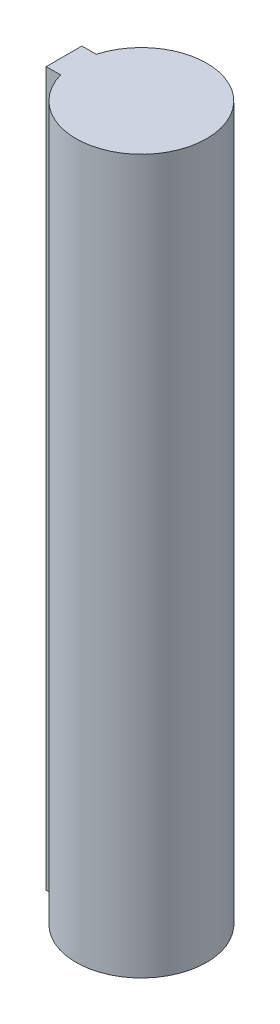
from build123d import *

# Parameters (mm, degrees)
BOSS_EXTRUDE1_DEPTH = 60


with BuildPart() as part:
    # Sketch1 → Boss-Extrude1 (new body)
    with BuildSketch(Plane(origin=(0, 0, 0), x_dir=(1, 0, 0), z_dir=(0, 1, 0))):
        with BuildLine():
            Line((-6.5, 1.5), (-5.291502622, 1.5))
            ThreePointArc((-5.291502622, 1.5), (5.5, 0), (-5.291502622, -1.5))
            Line((-5.291502622, -1.5), (-6.5, -1.5))
            Line((-6.5, -1.5), (-6.5, 1.5))
        make_face()
    extrude(amount=BOSS_EXTRUDE1_DEPTH)


solid = part.part
